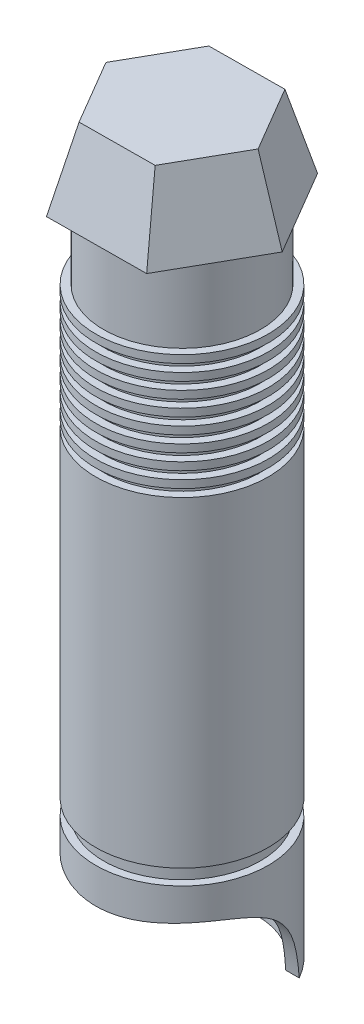
from build123d import *

# Parameters (mm, degrees)
BOSS_EXTRUDE2_DEPTH     = 20
BOSS_EXTRUDE2_TAPER     = 15
BOSS_EXTRUDE3_START     = 30
SKETCH5_R               = 22.3
SKETCH5_R_2             = 19.3
BOSS_EXTRUDE3_DEPTH     = 30
CUT_EXTRUDE1_DEPTH      = 30
CUT_EXTRUDE1_DEPTH_BACK = 30


with BuildPart() as part:
    # Sketch2 → Revolve1 (revolve)
    with BuildSketch(Plane.XY):
        Polygon((-19.3, 0), (-19.3, 140), (0, 140), (0, 141), (-20.3, 141), (-20.3, 140), (-20.3, 121), (-22.3, 121), (-22.3, 119), (-20.3, 119), (-20.3, 117), (-22.3, 117), (-22.3, 115), (-20.3, 115), (-20.3, 113), (-22.3, 113), (-22.3, 111), (-20.3, 111), (-20.3, 109), (-22.3, 109), (-22.3, 107), (-20.3, 107), (-20.3, 105), (-22.3, 105), (-22.3, 103), (-20.3, 103), (-20.3, 101), (-22.3, 101), (-22.3, 99), (-20.3, 99), (-20.3, 97), (-22.3, 97), (-22.3, 95), (-20.3, 95), (-20.3, 93), (-22.3, 93), (-22.3, 91), (-20.3, 91), (-20.3, 89), (-22.3, 89), (-22.3, 6), (-20.3, 6), (-20.3, 2), (-22.3, 2), (-22.3, 0), (-20.3, 0), align=None)
    revolve(axis=Axis((0, 0, 0), (0, 1, 0)))

    # Sketch3 → Boss-Extrude2 (add)
    with BuildSketch(Plane(origin=(0, 141, 0), x_dir=(1, 0, 0), z_dir=(0, 1, 0))):
        Polygon((12.685608816, 22.368412154), (-13.02880876, 22.170265574), (-25.714417576, -0.19814658), (-12.685608816, -22.368412154), (13.02880876, -22.170265574), (25.714417576, 0.19814658), align=None)
    extrude(amount=BOSS_EXTRUDE2_DEPTH, taper=BOSS_EXTRUDE2_TAPER)

    # Sketch5 → Boss-Extrude3 (add)
    with BuildSketch(Plane.XZ.offset(BOSS_EXTRUDE3_START)):
        Circle(SKETCH5_R)
        Circle(SKETCH5_R_2, mode=Mode.SUBTRACT)
    extrude(amount=-BOSS_EXTRUDE3_DEPTH)

    # Sketch6 → Cut-Extrude1 (cut, two sides: drawn at the far end of the back side and taken through both)
    with BuildSketch(Plane(origin=(0, 0, 0), x_dir=(0, 0, -1), z_dir=(1, 0, 0)).offset(-CUT_EXTRUDE1_DEPTH_BACK)):
        with BuildLine():
            add(Edge.make_bspline(
                [(-29.514134147, -8.8446486), (10.566504281, 2.828326519), (11.451543422, -38.297473123)],
                knots=[0, 0, 0, 1, 1, 1], degree=2))
            add(Edge.make_bspline(
                [(-29.514134147, -8.8446486), (-38.265876715, -53.637701487), (11.451543422, -38.297473123)],
                knots=[0, 0, 0, 1, 1, 1], degree=2))
        make_face()
    extrude(amount=CUT_EXTRUDE1_DEPTH + CUT_EXTRUDE1_DEPTH_BACK, mode=Mode.SUBTRACT)


solid = part.part
